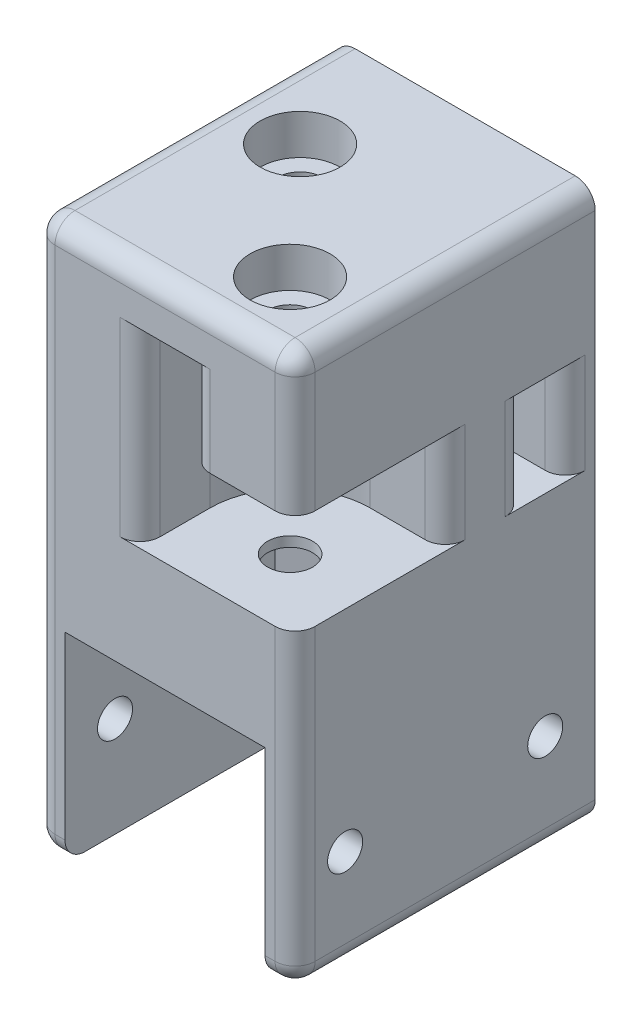
from build123d import *

# Parameters (mm, degrees)
SKETCH2_W                                           = 20
SKETCH2_H                                           = 30
BOSS_EXTRUDE1_DEPTH                                 = 30
SKETCH3_R                                           = 2.25
CUT_EXTRUDE2_DEPTH                                  = 19
SKETCH5_W                                           = 20
SKETCH5_H                                           = 30
BOSS_EXTRUDE2_DEPTH                                 = 5
SKETCH6_R                                           = 2.281198657
BOSS_EXTRUDE3_DEPTH                                 = 9
BOSS_EXTRUDE4_START                                 = 9
SKETCH7_R                                           = 2.25
BOSS_EXTRUDE4_DEPTH                                 = 9
BOSS_EXTRUDE6_DEPTH                                 = 9
SKETCH8_R                                           = 2.25
CUT_EXTRUDE3_DEPTH                                  = 40.37003937
CBORE_FOR_M4_HEX_SOCKET_HEAD_CAP_SCREW1_D           = 4.5
CBORE_FOR_M4_HEX_SOCKET_HEAD_CAP_SCREW1_DEPTH       = 35
CBORE_FOR_M4_HEX_SOCKET_HEAD_CAP_SCREW1_CBORE_D     = 8
CBORE_FOR_M4_HEX_SOCKET_HEAD_CAP_SCREW1_CBORE_DEPTH = 4
CUT_EXTRUDE6_DEPTH                                  = 10
CUT_EXTRUDE10_DEPTH                                 = 10
CUT_EXTRUDE11_DEPTH                                 = 10
SKETCH26_W                                          = 4
SKETCH26_H                                          = 10
CUT_EXTRUDE12_DEPTH                                 = 44.011626335
SKETCH32_W                                          = 30
SKETCH32_H                                          = 35
BOSS_EXTRUDE15_DEPTH                                = 3
SKETCH33_W                                          = 4
SKETCH33_H                                          = 10
BOSS_EXTRUDE16_DEPTH                                = 3
SKETCH34_W                                          = 3
SKETCH34_H                                          = 30
BOSS_EXTRUDE17_DEPTH                                = 20
SKETCH35_W                                          = 3
SKETCH35_H                                          = 30
BOSS_EXTRUDE18_DEPTH                                = 20
SKETCH37_R                                          = 1.75
CUT_EXTRUDE15_DEPTH                                 = 47.108567534
FILLET1_R_R                                         = 2
FILLET2_R_R                                         = 2


with BuildPart() as part:
    # Sketch2 → Boss-Extrude1 (new body)
    with BuildSketch(Plane(origin=(0, 0, 0), x_dir=(1, 0, 0), z_dir=(0, 1, 0))):
        Rectangle(SKETCH2_W, SKETCH2_H)
    extrude(amount=BOSS_EXTRUDE1_DEPTH)

    # Sketch3 → Cut-Extrude2 (cut)
    with BuildSketch(Plane(origin=(0, 30, 0), x_dir=(1, 0, 0), z_dir=(0, 1, 0))):
        with BuildLine():
            Line((-1.5, -15), (10, -15))
            Line((10, -15), (10, -1))
            Line((10, -1), (5.5, -1))
            ThreePointArc((5.5, -1), (3.403805654, -1.321229959), (1.5, -2.255437353))
            Line((1.5, -2.255437353), (1.5, 4))
            ThreePointArc((1.5, 4), (1.178770041, 6.096194346), (0.244562647, 8))
            Line((0.244562647, 8), (10, 8))
            Line((10, 8), (10, 11))
            Line((10, 11), (-10, 11))
            Line((-10, 11), (-10, -3))
            Line((-10, -3), (-5.5, -3))
            ThreePointArc((-5.5, -3), (-3.403805654, -2.678770041), (-1.5, -1.744562647))
            Line((-1.5, -1.744562647), (-1.5, -15))
        make_face()
        with Locations(Location((5.5, -8, 0), (0, 0, 270))):
            Circle(SKETCH3_R, mode=Mode.SUBTRACT)
        with Locations(Location((-5.5, 4, 0), (0, 0, 270))):
            Circle(SKETCH3_R, mode=Mode.SUBTRACT)
    extrude(amount=-CUT_EXTRUDE2_DEPTH, mode=Mode.SUBTRACT)

    # Sketch5 → Boss-Extrude2 (add)
    with BuildSketch(Plane(origin=(0, 30, 0), x_dir=(1, 0, 0), z_dir=(0, 1, 0))):
        Rectangle(SKETCH5_W, SKETCH5_H)
    extrude(amount=BOSS_EXTRUDE2_DEPTH)

    # Sketch6 → Boss-Extrude3 (add)
    with BuildSketch(Plane.XZ.offset(-30)):
        with BuildLine():
            Line((1.5, 2.255437353), (1.5, 15))
            Line((1.5, 15), (10, 15))
            Line((10, 15), (10, 1))
            Line((10, 1), (5.5, 1))
            ThreePointArc((5.5, 1), (3.403805654, 1.321229959), (1.5, 2.255437353))
        make_face()
        with Locations(Location((5.5, 8, 0), (0, 0, 270))):
            Circle(SKETCH6_R, mode=Mode.SUBTRACT)
    extrude(amount=BOSS_EXTRUDE3_DEPTH)

    # Sketch7 → Boss-Extrude4 (add)
    with BuildSketch(Plane(origin=(0, 11, 0), x_dir=(1, 0, 0), z_dir=(0, 1, 0)).offset(BOSS_EXTRUDE4_START)):
        with BuildLine():
            ThreePointArc((1.5, 4), (1.178770041, 6.096194346), (0.244562647, 8))
            Line((0.244562647, 8), (-10, 8))
            Line((-10, 8), (-10, -3))
            Line((-10, -3), (-5.5, -3))
            ThreePointArc((-5.5, -3), (-3.403805654, -2.678770041), (-1.5, -1.744562647))
            Line((-1.5, -1.744562647), (-1.5, -8))
            ThreePointArc((-1.5, -8), (-0.704836823, -4.759629651), (1.5, -2.255437353))
            Line((1.5, -2.255437353), (1.5, 4))
        make_face()
        with Locations((-5.5, 4)):
            Circle(SKETCH7_R, mode=Mode.SUBTRACT)
    extrude(amount=-BOSS_EXTRUDE4_DEPTH)

    # Sketch15 → Boss-Extrude6 (add)
    with BuildSketch(Plane.XZ.offset(-30)):
        with BuildLine():
            Line((10, -8), (10, -11))
            Line((10, -11), (-5.5, -11))
            ThreePointArc((-5.5, -11), (-2.259629651, -10.204836823), (0.244562647, -8))
            Line((0.244562647, -8), (10, -8))
        make_face()
    extrude(amount=BOSS_EXTRUDE6_DEPTH)

    # Sketch8 → Cut-Extrude3 (cut, through all)
    with BuildSketch(Plane(origin=(0, 35, 0), x_dir=(1, 0, 0), z_dir=(0, 1, 0))):
        with Locations(Location((5.5, -8, 0), (0, 0, 270))):
            Circle(SKETCH8_R)
        with Locations(Location((-5.5, 4, 0), (0, 0, 270))):
            Circle(SKETCH8_R)
    extrude(amount=-CUT_EXTRUDE3_DEPTH, mode=Mode.SUBTRACT)

    # CBORE for M4 Hex Socket Head Cap Screw1
    with Locations(Plane(origin=(0, 35, 0), x_dir=(1, 0, 0), z_dir=(0, 1, 0))):
        with Locations((5.5, -8), (-5.5, 4)):
            CounterBoreHole(CBORE_FOR_M4_HEX_SOCKET_HEAD_CAP_SCREW1_D / 2, CBORE_FOR_M4_HEX_SOCKET_HEAD_CAP_SCREW1_CBORE_D / 2, CBORE_FOR_M4_HEX_SOCKET_HEAD_CAP_SCREW1_CBORE_DEPTH, depth=CBORE_FOR_M4_HEX_SOCKET_HEAD_CAP_SCREW1_DEPTH)

    # Sketch14 → Cut-Extrude6 (cut)
    with BuildSketch(Plane.XZ):
        Polygon((5.5, 3.814210548), (9.125, 5.907105274), (9.125, 10.092894726), (5.5, 12.185789452), (1.875, 10.092894726), (1.875, 5.907105274), align=None)
        Polygon((-5.5, -8.185789452), (-1.875, -6.092894726), (-1.875, -1.907105274), (-5.5, 0.185789452), (-9.125, -1.907105274), (-9.125, -6.092894726), align=None)
    extrude(amount=-CUT_EXTRUDE6_DEPTH, mode=Mode.SUBTRACT)

    # Sketch24 → Cut-Extrude10 (cut)
    with BuildSketch(Plane(origin=(0, 11, 0), x_dir=(1, 0, 0), z_dir=(0, 1, 0))):
        with BuildLine():
            Line((-2.5, -16), (11, -16))
            Line((11, -16), (11, 0))
            Line((11, 0), (5.5, 0))
            ThreePointArc((5.5, 0), (-0.156854249, -2.343145751), (-2.5, -8))
            Line((-2.5, -8), (-2.5, -16))
        make_face()
    extrude(amount=CUT_EXTRUDE10_DEPTH, mode=Mode.SUBTRACT)

    # Sketch25 → Cut-Extrude11 (cut)
    with BuildSketch(Plane.XZ.offset(-30)):
        with BuildLine():
            Line((-10, -12), (-10, 4))
            Line((-10, 4), (-5.5, 4))
            ThreePointArc((-5.5, 4), (-3.9718619, 3.85269342), (-2.5, 3.416198487))
            Line((-2.5, 3.416198487), (-2.5, 15))
            Line((-2.5, 15), (2.5, 15))
            Line((2.5, 15), (2.5, -4))
            ThreePointArc((2.5, -4), (0.156854249, -9.656854249), (-5.5, -12))
            Line((-5.5, -12), (-10, -12))
        make_face()
    extrude(amount=CUT_EXTRUDE11_DEPTH, mode=Mode.SUBTRACT)

    # Sketch26 → Cut-Extrude12 (cut, through all)
    with BuildSketch(Plane.ZY.offset(10)):
        with Locations((-10, 16)):
            Rectangle(SKETCH26_W, SKETCH26_H)
    extrude(amount=-CUT_EXTRUDE12_DEPTH, mode=Mode.SUBTRACT)

    # Sketch32 → Boss-Extrude15 (add)
    with BuildSketch(Plane.ZY.offset(10)):
        with Locations((0, 17.5)):
            Rectangle(SKETCH32_W, SKETCH32_H)
        Polygon((-12, 11), (-8, 11), (-8, 20), (4, 20), (4, 30), (-12, 30), align=None, mode=Mode.SUBTRACT)
    extrude(amount=BOSS_EXTRUDE15_DEPTH)

    # Sketch33 → Boss-Extrude16 (add)
    with BuildSketch(Plane(origin=(10, 0, 0), x_dir=(0, 0, -1), z_dir=(1, 0, 0))):
        Polygon((15, 35), (15, 0), (-15, 0), (-15, 11), (0, 11), (0, 21), (-15, 21), (-15, 35), align=None)
        with Locations((10, 16)):
            Rectangle(SKETCH33_W, SKETCH33_H, mode=Mode.SUBTRACT)
    extrude(amount=BOSS_EXTRUDE16_DEPTH)

    # Sketch34 → Boss-Extrude17 (add)
    with BuildSketch(Plane.XZ):
        with Locations((-11.5, 0)):
            Rectangle(SKETCH34_W, SKETCH34_H)
    extrude(amount=BOSS_EXTRUDE17_DEPTH)

    # Sketch35 → Boss-Extrude18 (add)
    with BuildSketch(Plane.XZ):
        with Locations((11.5, 0)):
            Rectangle(SKETCH35_W, SKETCH35_H)
    extrude(amount=BOSS_EXTRUDE18_DEPTH)

    # Sketch37 → Cut-Extrude15 (cut, through all)
    with BuildSketch(Plane.ZY.offset(13)):
        with Locations((-10, -10)):
            Circle(SKETCH37_R)
        with Locations((10, -10)):
            Circle(SKETCH37_R)
    extrude(amount=-CUT_EXTRUDE15_DEPTH, mode=Mode.SUBTRACT)

    # Fillet1-r
    fillet1_r_edges = [part.edges().sort_by_distance(p)[0] for p in [
        (-13, 7.5, 15),
        (-13, 35, 0),
        (13, 35, 0),
        (13, 28, 15),
        (13, -4.5, 15),
        (-13, -20, 0),
        (-11.5, -20, 15),
        (13, -20, 0),
        (11.5, -20, 15),
        (0, 35, 15),
    ]]
    fillet(fillet1_r_edges, radius=FILLET1_R_R)

    # Fillet2-r
    fillet2_r_edges = [part.edges().sort_by_distance(p)[0] for p in [
        (-2.5, 20.5, 15),
        (2.5, 25.5, 15),
        (-2.5, 25, 3.416198487),
        (-13, 20.5, -12),
        (-13, 15.5, -8),
        (-13, 25, 4),
        (13, 16, 0),
        (13, 16, -8),
        (13, 16, -12),
    ]]
    fillet(fillet2_r_edges, radius=FILLET2_R_R)


solid = part.part
